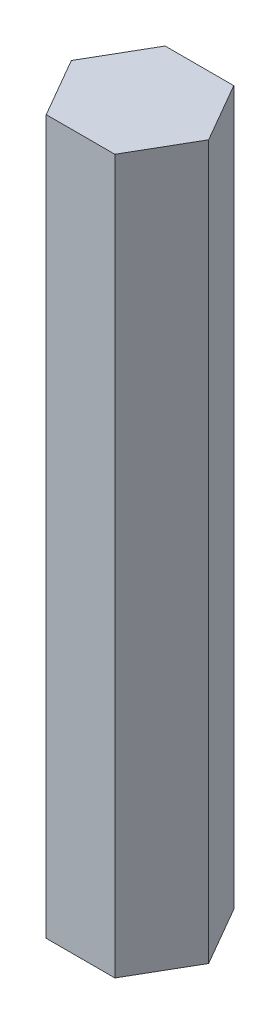
from build123d import *

# Parameters (mm, degrees)
BOSS_EXTRUDE1_DEPTH = 30


with BuildPart() as part:
    # Sketch1 → Boss-Extrude1 (new body)
    with BuildSketch(Plane(origin=(0, 0, 0), x_dir=(1, 0, 0), z_dir=(0, 1, 0))):
        Polygon((2.886751346, 0), (1.443375673, 2.5), (-1.443375673, 2.5), (-2.886751346, 0), (-1.443375673, -2.5), (1.443375673, -2.5), align=None)
    extrude(amount=BOSS_EXTRUDE1_DEPTH)


solid = part.part
